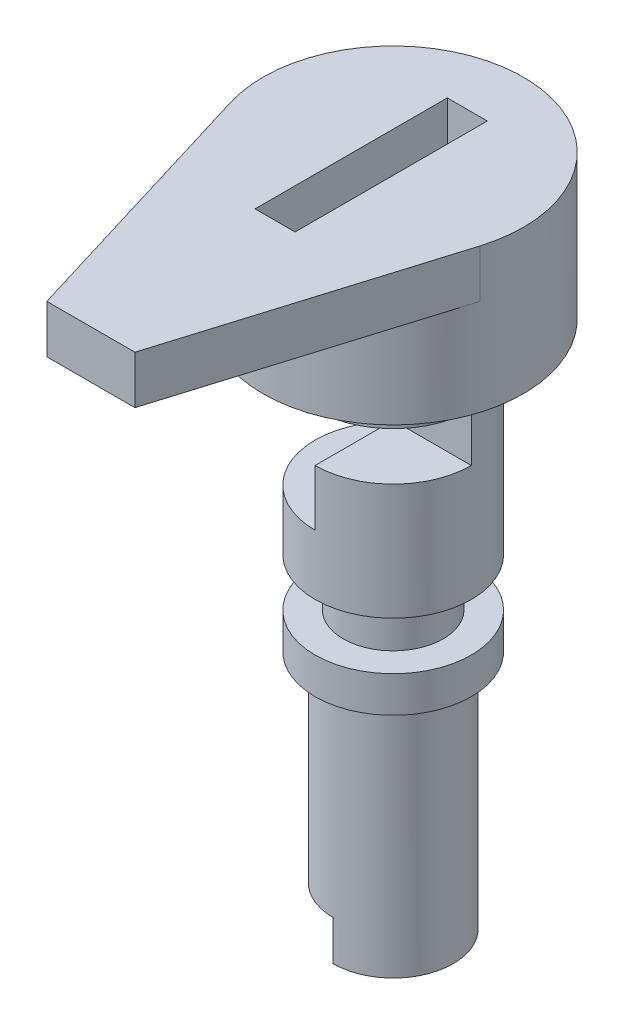
from build123d import *

# Parameters (mm, degrees)
BASES_R              = 3.25
BASE_DEPTH           = 2.4
TOPSHAFTS_R          = 1.95
TOPSHAFT_DEPTH       = 7.2
MAINSLOT_DEPTH       = 9.54195528
MAINSLOT_DEPTH_BACK  = 9.54195528
MAINSLOTS_W          = 1.95
MAINSLOTS_H          = 2.6
SMALLSLOT_DEPTH      = 9.54195528
SMALLSLOT_DEPTH_BACK = 9.54195528
SMALLSLOTS_W         = 1.95
SMALLSLOTS_H         = 1.2
O_RINGGROOVES_W      = 0.7
O_RINGGROOVES_H      = 1.2
BOTTOMSHAFTS_R       = 1.5
BOTTOMSHAFT_DEPTH    = 6
TAB_DEPTH            = 1.2
SCREWCUT_ANGLE       = 180
KEYWAYS_W            = 1
KEYWAYS_H            = 4.8
KEYWAY_DEPTH         = 1


with BuildPart() as part:
    # BaseS → Base (new body)
    with BuildSketch(Plane(origin=(0, 0, 0), x_dir=(1, 0, 0), z_dir=(0, 1, 0))):
        with Locations(Location((0, 0, 0), (0, 0, 270))):
            Circle(BASES_R)
    extrude(amount=BASE_DEPTH)

    # TopShaftS → TopShaft (add)
    with BuildSketch(Plane(origin=(0, 0, 0), x_dir=(-1, 0, 0), z_dir=(0, -1, 0))):
        with Locations(Location((0, 0, 0), (0, 0, 90))):
            Circle(TOPSHAFTS_R)
    extrude(amount=TOPSHAFT_DEPTH)

    # MainSlotS → MainSlot (cut, two sides: drawn at the far end of the back side and taken through both)
    with BuildSketch(Plane.XY.offset(-MAINSLOT_DEPTH_BACK)):
        with Locations((-0.975, -2.3)):
            Rectangle(MAINSLOTS_W, MAINSLOTS_H)
    extrude(amount=MAINSLOT_DEPTH + MAINSLOT_DEPTH_BACK, mode=Mode.SUBTRACT)

    # SmallSlotS → SmallSlot (cut, two sides: drawn at the far end of the back side and taken through both)
    with BuildSketch(Plane(origin=(0, 0, 0), x_dir=(0, 0, -1), z_dir=(1, 0, 0)).offset(-SMALLSLOT_DEPTH_BACK)):
        with Locations((-0.975, -1.6)):
            Rectangle(SMALLSLOTS_W, SMALLSLOTS_H)
    extrude(amount=SMALLSLOT_DEPTH + SMALLSLOT_DEPTH_BACK, mode=Mode.SUBTRACT)

    # O-RingGrooveS → O-RingGroove (revolve, cut)
    with BuildSketch(Plane.XY, mode=Mode.PRIVATE) as o_ringgroove_sk:
        with Locations((-1.6, -5.7)):
            Rectangle(O_RINGGROOVES_W, O_RINGGROOVES_H)
    revolve(o_ringgroove_sk.sketch.rotate(Axis((0, 0, 0), (0, -1, 0)), 270), axis=Axis((0, 0, 0), (0, -1, 0)), mode=Mode.SUBTRACT)

    # BottomShaftS → BottomShaft (add)
    with BuildSketch(Plane.XZ.offset(7.2)):
        with Locations(Location((0, 0, 0), (0, 0, 270))):
            Circle(BOTTOMSHAFTS_R)
    extrude(amount=BOTTOMSHAFT_DEPTH)

    # TabS → Tab (add)
    with BuildSketch(Plane(origin=(0, 2.4, 0), x_dir=(1, 0, 0), z_dir=(0, 1, 0))):
        with BuildLine():
            Line((-3.109273923, -0.945999826), (-1.1, -7.55))
            Line((-1.1, -7.55), (1.1, -7.55))
            Line((1.1, -7.55), (3.109273923, -0.945999826))
            ThreePointArc((3.109273923, -0.945999826), (0, 3.25), (-3.109273923, -0.945999826))
        make_face()
    extrude(amount=TAB_DEPTH)

    # ScrewCutS → ScrewCut (revolve, symmetric, cut)
    with BuildSketch(Plane.XY) as screwcut_sk:
        Polygon((-0.01, -13.2), (-1.5, -12.2), (-1.5, -13.2), align=None)
    revolve(axis=Axis((0, 4.44, 0), (0, -1, 0)), revolution_arc=SCREWCUT_ANGLE / 2, mode=Mode.SUBTRACT)
    revolve(screwcut_sk.sketch, axis=Axis((0, 4.44, 0), (0, 1, 0)), revolution_arc=SCREWCUT_ANGLE / 2, mode=Mode.SUBTRACT)

    # KeyWayS → KeyWay (cut)
    with BuildSketch(Plane(origin=(0, 3.6, 0), x_dir=(1, 0, 0), z_dir=(0, 1, 0))):
        with Locations((0, -0.55)):
            Rectangle(KEYWAYS_W, KEYWAYS_H)
    extrude(amount=-KEYWAY_DEPTH, mode=Mode.SUBTRACT)


solid = part.part
